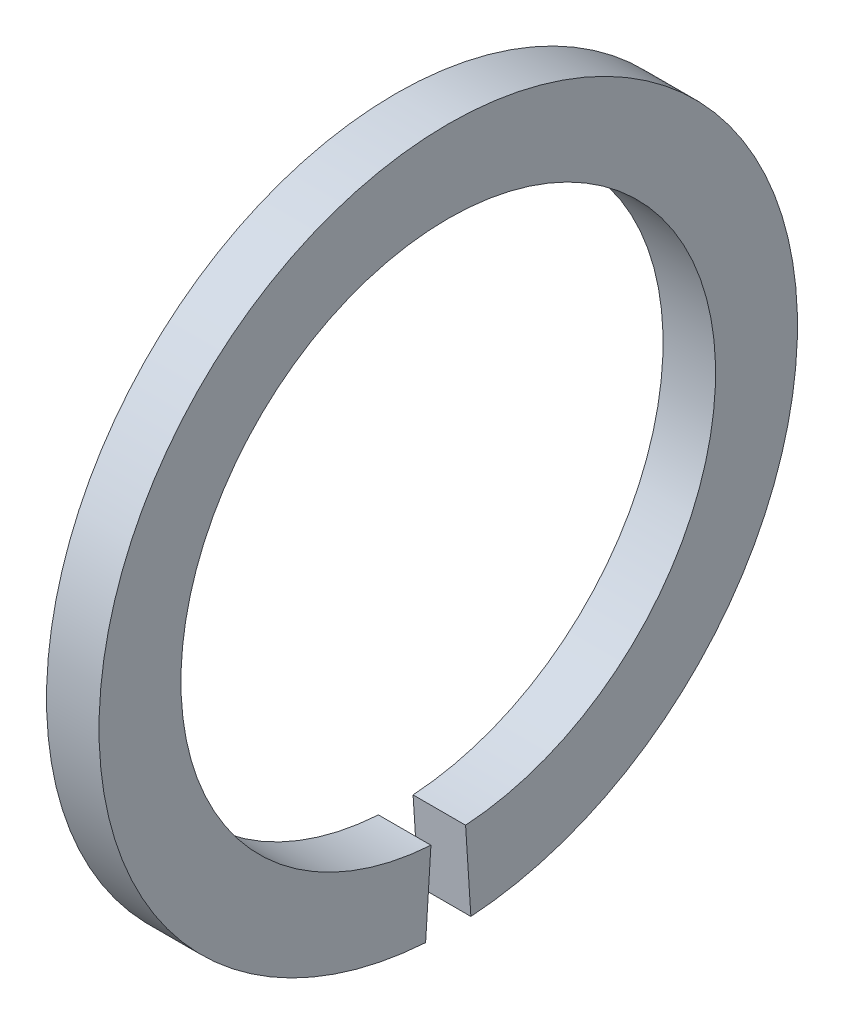
from build123d import *

# Parameters (mm, degrees)
BOSS_EXTRUDE1_DEPTH = 1.09


with BuildPart() as part:
    # Sketch1 → Boss-Extrude1 (new body)
    with BuildSketch(Plane(origin=(0, 0, 0), x_dir=(0, 0, -1), z_dir=(1, 0, 0))):
        with BuildLine():
            Line((-0.35973286, -5.538329375), (-0.469921303, -7.234754589))
            ThreePointArc((-0.469921303, -7.234754589), (0, 7.25), (0.469921303, -7.234754589))
            Line((0.469921303, -7.234754589), (0.35973286, -5.538329375))
            ThreePointArc((0.35973286, -5.538329375), (0, 5.55), (-0.35973286, -5.538329375))
        make_face()
    extrude(amount=BOSS_EXTRUDE1_DEPTH)


solid = part.part
